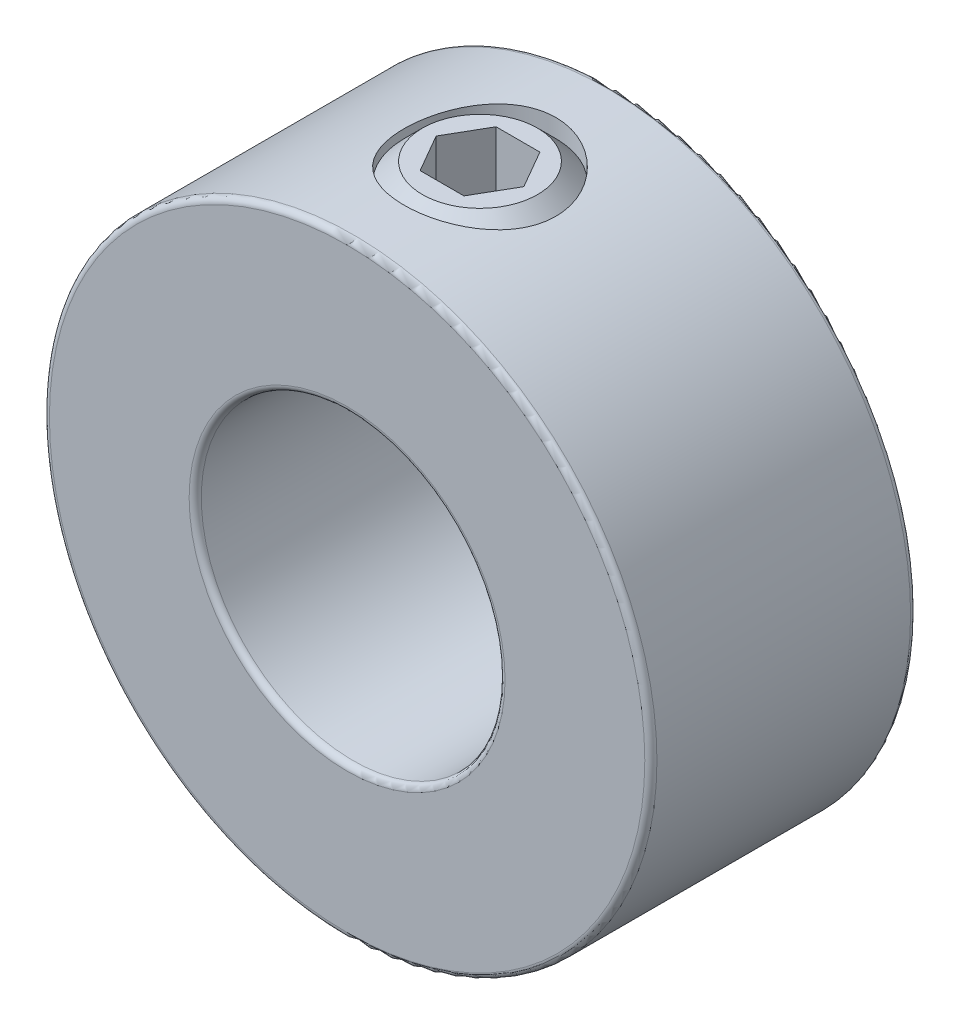
from build123d import *

# Parameters (mm, degrees)
SKETCH1_R          = 12.7
SKETCH1_R_2        = 6.35
EXTRUDE1_DEPTH     = 5.55625
SKETCH2_R          = 3.175
CUT_EXTRUDE1_DEPTH = 56.726677086
FILLET1_R          = 0.254
CUT_EXTRUDE2_DEPTH = 3.175


with BuildPart() as part:
    # Sketch1 → Extrude1 (new, symmetric)
    with BuildSketch(Plane.XY):
        Circle(SKETCH1_R)
        Circle(SKETCH1_R_2, mode=Mode.SUBTRACT)
    extrude(amount=EXTRUDE1_DEPTH, both=True)

    # Sketch2 → Cut-Extrude1 (cut, through all)
    with BuildSketch(Plane(origin=(41.275, 0, 0), x_dir=(0, 0, -1), z_dir=(0, -1, 0))):
        with Locations((0, -41.275)):
            Circle(SKETCH2_R)
    extrude(amount=-CUT_EXTRUDE1_DEPTH, mode=Mode.SUBTRACT)

    # Fillet1
    fillet1_edges = [part.edges().sort_by_distance(p)[0] for p in [
        (-12.7, 0, -5.55625),
        (-12.7, 0, 5.55625),
        (-6.35, 0, -5.55625),
        (-6.35, 0, 5.55625),
    ]]
    fillet(fillet1_edges, radius=FILLET1_R)


with BuildPart() as body_2:
    # Sketch3 → Revolve1 (revolve)
    with BuildSketch(Plane.XY):
        Polygon((-2.408192631, 6.35), (-0.920168843, 6.35), (0, 7.270168843), (0, 12.7), (-2.408192631, 12.7), (-3.175, 11.933192631), (-3.175, 7.116807369), align=None)
    revolve(axis=Axis((0, 6.35, 0), (0, -1, 0)))

    # Sketch4 → Cut-Extrude2 (cut)
    with BuildSketch(Plane(origin=(3.3734375, 12.7, 0), x_dir=(0, 0, -1), z_dir=(0, -1, 0))):
        Polygon((0, -1.540350395), (-1.5875, -2.456893948), (-1.5875, -4.289981052), (0, -5.206524605), (1.5875, -4.289981052), (1.5875, -2.456893948), align=None)
    extrude(amount=CUT_EXTRUDE2_DEPTH, mode=Mode.SUBTRACT)


solid = Compound([part.part, body_2.part])
